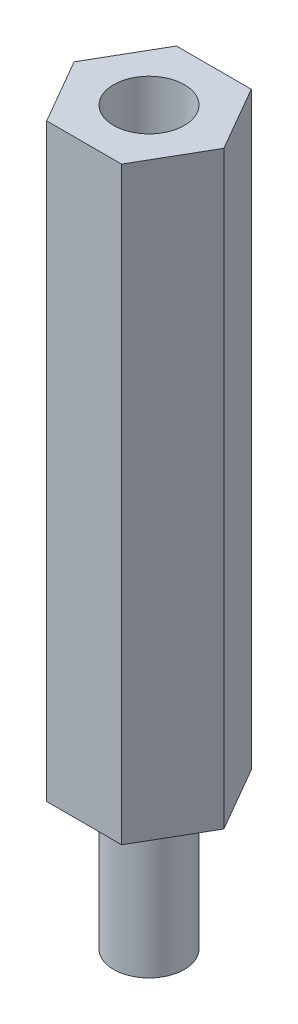
from build123d import *

# Parameters (mm, degrees)
BOSS_EXTRUDE1_DEPTH = 25
SKETCH2_R           = 1.5
CUT_EXTRUDE1_DEPTH  = 12
SKETCH3_R           = 1.5
BOSS_EXTRUDE2_DEPTH = 6


with BuildPart() as part:
    # Sketch1 → Boss-Extrude1 (new body)
    with BuildSketch(Plane(origin=(0, 0, 0), x_dir=(1, 0, 0), z_dir=(0, 1, 0))):
        Polygon((3.175426481, 0), (1.58771324, 2.75), (-1.58771324, 2.75), (-3.175426481, 0), (-1.58771324, -2.75), (1.58771324, -2.75), align=None)
    extrude(amount=BOSS_EXTRUDE1_DEPTH)

    # Sketch2 → Cut-Extrude1 (cut)
    with BuildSketch(Plane(origin=(0, 25, 0), x_dir=(1, 0, 0), z_dir=(0, 1, 0))):
        with Locations(Location((0, 0, 0), (0, 0, 270))):
            Circle(SKETCH2_R)
    extrude(amount=-CUT_EXTRUDE1_DEPTH, mode=Mode.SUBTRACT)

    # Sketch3 → Boss-Extrude2 (add)
    with BuildSketch(Plane(origin=(0, 0, 0), x_dir=(-1, 0, 0), z_dir=(0, -1, 0))):
        with Locations(Location((0, 0, 0), (0, 0, 270))):
            Circle(SKETCH3_R)
    extrude(amount=BOSS_EXTRUDE2_DEPTH)


solid = part.part
